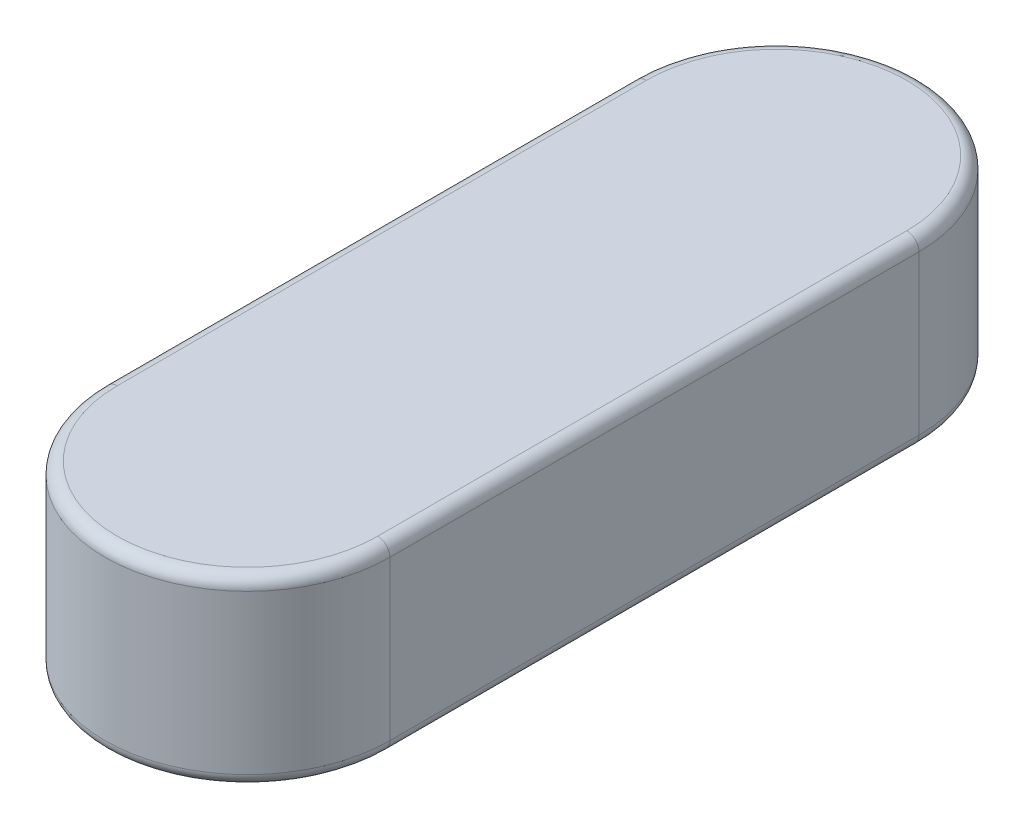
from build123d import *

# Parameters (mm, degrees)
EXTRUDE_1_DEPTH = 9
FILLET_1_R      = 0.6


with BuildPart() as part:
    # Эскиз1 → Бобышка-Вытянуть1 (new body)
    with BuildSketch(Plane(origin=(0, 0, 0), x_dir=(1, 0, 0), z_dir=(0, 1, 0))):
        with BuildLine():
            Line((-7, 0), (-7, 26))
            ThreePointArc((-7, 26), (0, 33), (7, 26))
            Line((7, 26), (7, 0))
            ThreePointArc((7, 0), (0, -7), (-7, 0))
        make_face()
    extrude(amount=EXTRUDE_1_DEPTH)

    # Скругление1
    fillet_1_edges = [part.edges().sort_by_distance(p)[0] for p in [
        (0, 9, -33),
        (-7, 9, -13),
        (0, 9, 7),
        (-7, 0, -13),
        (0, 0, -33),
        (7, 0, -13),
        (0, 0, 7),
        (7, 9, -13),
    ]]
    fillet(fillet_1_edges, radius=FILLET_1_R)


solid = part.part
